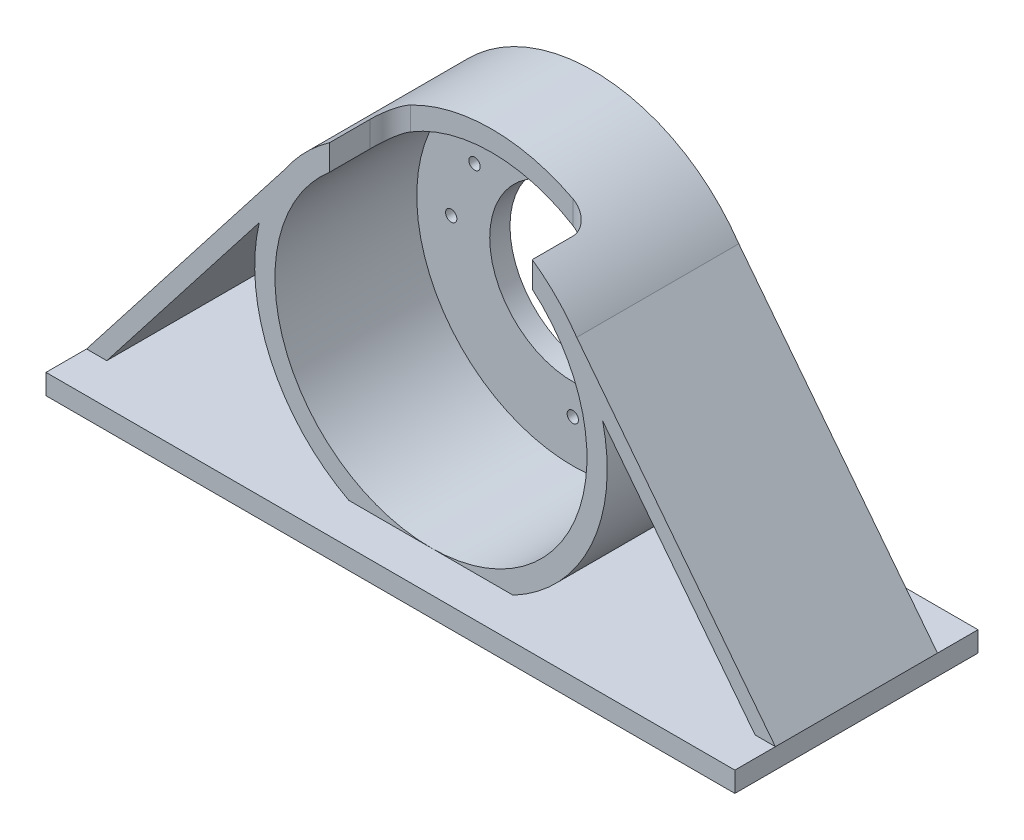
from build123d import *

# Parameters (mm, degrees)
SKETCH17_R                                        = 43.5
BOSS_EXTRUDE1_DEPTH                               = 5
SKETCH19_R                                        = 43.5
SKETCH19_R_2                                      = 38.5
BOSS_EXTRUDE2_DEPTH                               = 35
SKETCH20_R                                        = 20.5
CUT_EXTRUDE1_DEPTH                                = 5
SKETCH26_W                                        = 170
SKETCH26_H                                        = 60
BOSS_EXTRUDE3_DEPTH                               = 5
BOSS_EXTRUDE4_DEPTH                               = 40
CSK_FOR_3_FLAT_HEAD_MACHINE_SCREW_100_D           = 2.794
CSK_FOR_3_FLAT_HEAD_MACHINE_SCREW_100_CSINK_D     = 5.0546
CSK_FOR_3_FLAT_HEAD_MACHINE_SCREW_100_CSINK_ANGLE = 100
CUT_EXTRUDE2_DEPTH                                = 40


with BuildPart() as part:
    # Sketch17 → Boss-Extrude1 (new body)
    with BuildSketch(Plane.XY):
        Circle(SKETCH17_R)
    extrude(amount=BOSS_EXTRUDE1_DEPTH)

    # Sketch19 → Boss-Extrude2 (add)
    with BuildSketch(Plane.XY.offset(5)):
        Circle(SKETCH19_R)
        Circle(SKETCH19_R_2, mode=Mode.SUBTRACT)
    extrude(amount=BOSS_EXTRUDE2_DEPTH)

    # Sketch20 → Cut-Extrude1 (cut)
    with BuildSketch(Plane(origin=(0, 0, 0), x_dir=(-1, 0, 0), z_dir=(0, 0, -1))):
        Circle(SKETCH20_R)
    extrude(amount=-CUT_EXTRUDE1_DEPTH, mode=Mode.SUBTRACT)

    # Sketch26 → Boss-Extrude3 (add)
    with BuildSketch(Plane(origin=(0, -43.5, 0), x_dir=(1, 0, 0), z_dir=(0, 1, 0))):
        with Locations((0, -20)):
            Rectangle(SKETCH26_W, SKETCH26_H)
    extrude(amount=BOSS_EXTRUDE3_DEPTH)

    # Sketch27 → Boss-Extrude4 (add)
    with BuildSketch(Plane.XY.offset(40)):
        Polygon((-85, -38.5), (-32.53104334, 28.878732991), (-42.379072789, 9.811431574), (-80, -38.5), align=None)
        Polygon((32.53104334, 28.878732991), (42.379072789, 9.811431574), (80, -38.5), (85, -38.5), align=None)
    extrude(amount=-BOSS_EXTRUDE4_DEPTH)

    # CSK for #3 Flat Head Machine Screw (100)4 (through all)
    with Locations(Plane(origin=(0, 0, 0), x_dir=(-1, 0, 0), z_dir=(0, 0, -1))):
        with Locations((-24.248711306, 14), (-15, 25.980762114), (24.248711306, 14), (30, 0), (0, -28), (-15, -25.980762114)):
            CounterSinkHole(CSK_FOR_3_FLAT_HEAD_MACHINE_SCREW_100_D / 2, CSK_FOR_3_FLAT_HEAD_MACHINE_SCREW_100_CSINK_D / 2, counter_sink_angle=CSK_FOR_3_FLAT_HEAD_MACHINE_SCREW_100_CSINK_ANGLE)

    # Sketch34 → Cut-Extrude2 (cut)
    with BuildSketch(Plane(origin=(0, 43.5, 0), x_dir=(1, 0, 0), z_dir=(0, 1, 0))):
        with BuildLine():
            Line((-25, -40), (25, -40))
            Line((25, -40), (25, -30))
            ThreePointArc((25, -30), (23.535533906, -26.464466094), (20, -25))
            Line((20, -25), (-20, -25))
            ThreePointArc((-20, -25), (-23.535533906, -26.464466094), (-25, -30))
            Line((-25, -30), (-25, -40))
        make_face()
    extrude(amount=-CUT_EXTRUDE2_DEPTH, mode=Mode.SUBTRACT)


solid = part.part
